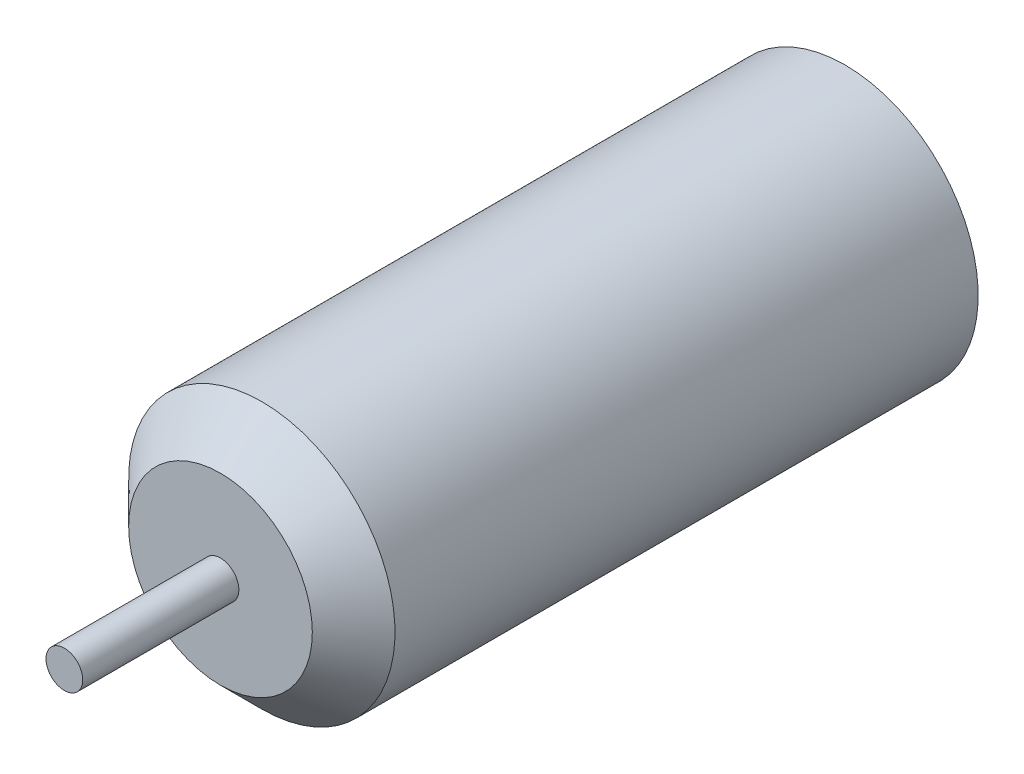
from build123d import *


with BuildPart() as part:
    # Sketch3 → Revolve1 (revolve)
    with BuildSketch(Plane(origin=(0, 0, 0), x_dir=(0, 0, -1), z_dir=(1, 0, 0))):
        Polygon((0, 0), (0, 2), (17, 2), (17, 10), (21.5, 14.5), (85, 14.5), (85, 0), align=None)
    revolve(axis=Axis((0, 0, -85), (0, 0, 1)))


solid = part.part
